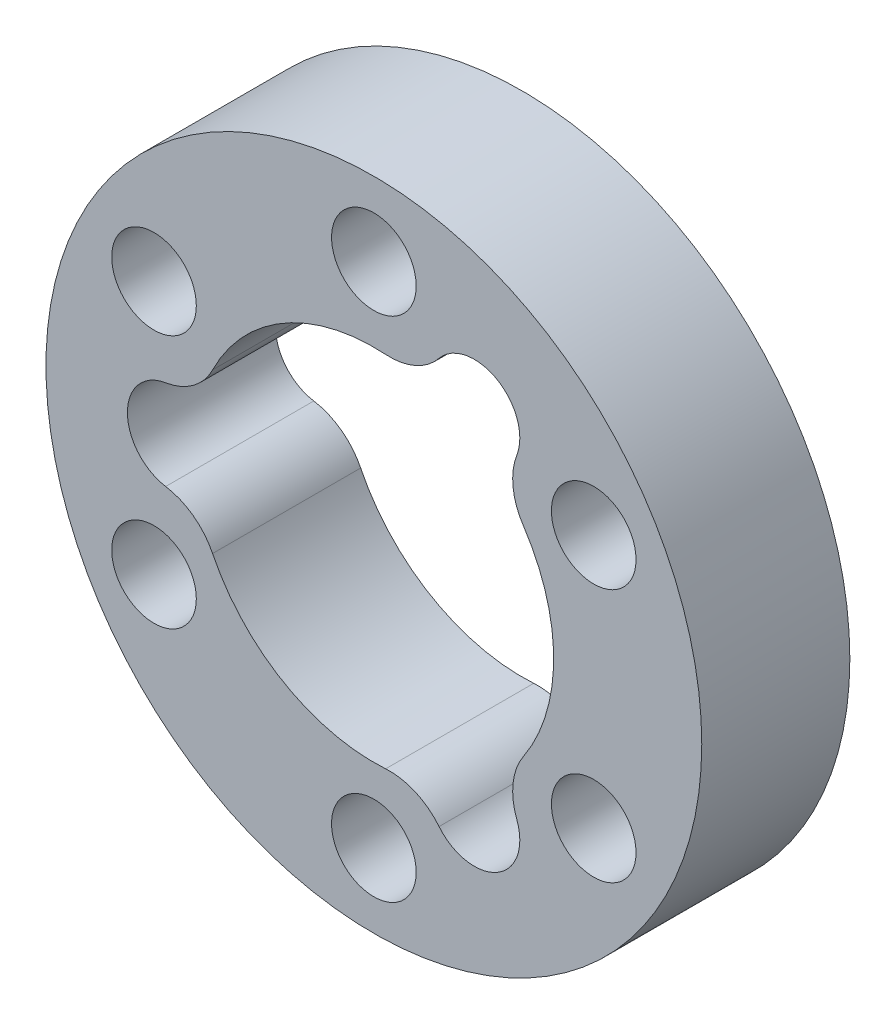
from build123d import *

# Parameters (mm, degrees)
SKETCH_1_R      = 15.5
SKETCH_1_R_2    = 2
EXTRUDE_1_DEPTH = 7
FILLET_1_R      = 3


with BuildPart() as part:
    # 草图1 → 凸台-拉伸1 (new body)
    with BuildSketch(Plane.XY):
        Circle(SKETCH_1_R)
        with Locations((-10.392304845, -6)):
            Circle(SKETCH_1_R_2, mode=Mode.SUBTRACT)
        with Locations((0, -12)):
            Circle(SKETCH_1_R_2, mode=Mode.SUBTRACT)
        with Locations((10.392304845, -6)):
            Circle(SKETCH_1_R_2, mode=Mode.SUBTRACT)
        with Locations((-10.392304845, 6)):
            Circle(SKETCH_1_R_2, mode=Mode.SUBTRACT)
        with BuildLine():
            ThreePointArc((2.604308084, 8.091203829), (4.681947148, 10.376164045), (6.9, 8.227241336))
            ThreePointArc((6.9, 8.227241336), (6.576995231, 7.093844482), (5.705034021, 6.300998875))
            ThreePointArc((5.705034021, 6.300998875), (7.769903126, 3.446535276), (8.5, 0))
            ThreePointArc((8.5, 0), (7.769903126, -3.446535276), (5.705034021, -6.300998875))
            ThreePointArc((5.705034021, -6.300998875), (6.576995231, -7.093844482), (6.9, -8.227241336))
            ThreePointArc((6.9, -8.227241336), (4.681947148, -10.376164045), (2.604308084, -8.091203829))
            ThreePointArc((2.604308084, -8.091203829), (-4.25, -7.361215932), (-8.309342105, -1.790204954))
            ThreePointArc((-8.309342105, -1.790204954), (-11.65, 0), (-8.309342105, 1.790204954))
            ThreePointArc((-8.309342105, 1.790204954), (-4.25, 7.361215932), (2.604308084, 8.091203829))
        make_face(mode=Mode.SUBTRACT)
        with Locations((10.392304845, 6)):
            Circle(SKETCH_1_R_2, mode=Mode.SUBTRACT)
        with Locations((0, 12)):
            Circle(SKETCH_1_R_2, mode=Mode.SUBTRACT)
    extrude(amount=EXTRUDE_1_DEPTH)

    # 圆角1
    fillet_1_edges = [part.edges().sort_by_distance(p)[0] for p in [
        (-8.309342105, 1.790204954, 3.5),
        (-8.309342105, -1.790204954, 3.5),
        (2.604308084, -8.091203829, 3.5),
        (5.705034021, -6.300998875, 3.5),
        (5.705034021, 6.300998875, 3.5),
        (2.604308084, 8.091203829, 3.5),
    ]]
    fillet(fillet_1_edges, radius=FILLET_1_R)


solid = part.part
